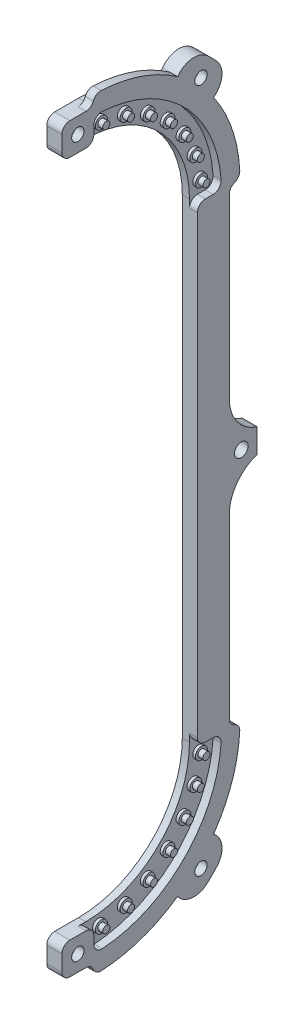
from build123d import *

# Parameters (mm, degrees)
SKETCH_1_R             = 1.6499999999999997
SKETCH_1_R_2           = 1.6499999999999986
SKETCH_1_R_3           = 1.6500000000000017
EXTRUDE_1_DEPTH        = 1.8
FILLET_1_R             = 5
FILLET_2_R             = 2
EXTRUDE_START          = 2
SKETCH_2_R             = 1.55
SKETCH_2_R_2           = 1.5500000000000007
SKETCH_2_R_3           = 1.5500000000000018
EXTRUDE_2_DEPTH        = 2
FILLET_3_R             = 2
FILLET_4_R             = 2
SKETCH_3_R             = 1.5000000000000009
SKETCH_3_R_2           = 1.4999999999999931
SKETCH_3_R_3           = 1.5000000000000007
SKETCH_3_R_4           = 1.5000000000000029
SKETCH_3_R_5           = 1.4999999999999967
EXTRUDE_3_DEPTH        = 0.7
SKETCH_4_R             = 0.9000000000000004
SKETCH_4_R_2           = 0.9000000000000007
SKETCH_4_R_3           = 0.9000000000000002
EXTRUDE_4_DEPTH        = 1.25
SKETCH_5_R             = 1.6499999999999986
EXTRUDE_5_DEPTH        = 3.8
FILLET_1_OF_MIRROR_2_R = 5
FILLET_2_OF_MIRROR_2_R = 2
FILLET_3_OF_MIRROR_2_R = 2
FILLET_4_OF_MIRROR_2_R = 2
SKETCH_6_R             = 1.6999999999999995
EXTRUDE_7_DEPTH        = 3.8
FILLET_5_R             = 10


with BuildPart() as part:
    # 草图1 → 凸台-拉伸1 (new body)
    with BuildSketch(Plane(origin=(0, 0, 0), x_dir=(0, 0, -1), z_dir=(1, 0, 0))):
        with BuildLine():
            Line((0, 26.000000000000004), (-8, 26.000000000000004))
            Line((-8, 26.000000000000004), (-8, 34))
            Line((-8, 34), (0, 34))
            ThreePointArc((0, 34), (10.223997183145261, 32.426376325439726), (19.50159883593553, 27.851169505825748))
            Line((19.50159883593553, 27.851169505825748), (24.090210326743893, 34.404385860137694))
            ThreePointArc((24.090210326743893, 34.404385860137694), (29.69848480983498, 29.698484809835016), (34.40438586013765, 24.090210326743936))
            Line((34.40438586013765, 24.090210326743936), (27.85116950582572, 19.50159883593557))
            ThreePointArc((27.85116950582572, 19.50159883593557), (32.42637632543972, 10.22399718314529), (34.00000000000001, 0))
            Line((34.00000000000001, 0), (34.00000000000002, -59.01000000000001))
            Line((34.00000000000002, -59.01000000000001), (26.00000000000003, -59.01000000000001))
            Line((26.00000000000003, -59.01000000000001), (26.000000000000004, 0))
            ThreePointArc((26.000000000000004, 0), (18.38477631085024, 18.384776310850235), (0, 26.000000000000004))
        make_face()
        with Locations((-4.000000000000001, 30.000000000000004)):
            Circle(SKETCH_1_R, mode=Mode.SUBTRACT)
        with Locations((26.870057685088806, 26.870057685088806)):
            Circle(SKETCH_1_R_2, mode=Mode.SUBTRACT)
        with Locations((30.00000000000003, -55.01000000000003)):
            Circle(SKETCH_1_R_3, mode=Mode.SUBTRACT)
    extrude_1 = extrude(amount=EXTRUDE_1_DEPTH)

    # 圆角1
    fillet_1_edges = [part.edges().sort_by_distance(p)[0] for p in [
        (0.9, 34.404385860137694, -24.090210326743893),
        (0.9, 24.090210326743936, -34.40438586013765),
    ]]
    fillet(fillet_1_edges, radius=FILLET_1_R)

    # 圆角2
    fillet_2_edges = [part.edges().sort_by_distance(p)[0] for p in [
        (0.9, 19.50159883593557, -27.851169505825716),
        (0.9, 26.000000000000004, 8),
        (0.9, 34, 8),
        (0.9, 27.851169505825744, -19.50159883593553),
    ]]
    fillet(fillet_2_edges, radius=FILLET_2_R)

    # 草图2 → 凸台-拉伸2 (add)
    with BuildSketch(Plane(origin=(1.8, 0, 0), x_dir=(0, 0, -1), z_dir=(1, 0, 0)).offset(EXTRUDE_START)):
        with BuildLine():
            Line((1.59e-15, 26.000000000000004), (0, 32))
            ThreePointArc((0, 32), (22.627416997969522, 22.62741699796952), (32, 0))
            Line((32, 0), (26.000000000000004, 0))
            Line((26.000000000000004, 0), (26.00000000000003, -59.01000000000001))
            Line((26.00000000000003, -59.01000000000001), (34.00000000000002, -59.01000000000001))
            Line((34.00000000000002, -59.01000000000001), (34, 0))
            Line((34, 0), (36.66060555964673, 0))
            ThreePointArc((36.66060555964673, 0), (34.96384094692978, 11.024056705124373), (30.030609989056998, 21.027659491373523))
            ThreePointArc((30.030609989056998, 21.027659491373523), (32.13426168184526, 24.590643085828816), (30.833366700180378, 28.518476430766917))
            ThreePointArc((30.833366700180378, 28.518476430766917), (29.69848480983498, 29.698484809835023), (28.518476430766874, 30.83336670018042))
            ThreePointArc((28.518476430766874, 30.83336670018042), (24.59064308582877, 32.1342616818453), (21.027659491373477, 30.030609989057027))
            ThreePointArc((21.027659491373477, 30.030609989057027), (11.024056705124345, 34.963840946929786), (0, 36.66060555964673))
            Line((0, 36.66060555964673), (0, 34))
            Line((0, 34), (-6, 34))
            ThreePointArc((-6, 34), (-7.414213562373095, 33.41421356237309), (-8, 32))
            Line((-8, 32), (-8, 28.000000000000004))
            ThreePointArc((-8, 28.000000000000004), (-7.414213562373096, 26.585786437626908), (-6, 26.000000000000004))
            Line((-6, 26.000000000000004), (1.59e-15, 26.000000000000004))
        make_face()
        with Locations((-4.000000000000001, 30.000000000000004)):
            Circle(SKETCH_2_R, mode=Mode.SUBTRACT)
        with Locations((26.870057685088806, 26.870057685088806)):
            Circle(SKETCH_2_R_2, mode=Mode.SUBTRACT)
        with Locations((30.00000000000003, -55.01000000000003)):
            Circle(SKETCH_2_R_3, mode=Mode.SUBTRACT)
    extrude_2 = extrude(amount=-EXTRUDE_2_DEPTH)

    # 圆角3
    fillet_3_edges = [part.edges().sort_by_distance(p)[0] for p in [
        (2.8, 0, -34),
        (2.8, 34, 0),
        (2.8, 26.000000000000004, -1.59e-15),
        (2.8, 32, 0),
        (2.8, 9.8e-16, -32),
        (2.8, 0, -26.000000000000004),
    ]]
    fillet(fillet_3_edges, radius=FILLET_3_R)

    # 圆角4
    fillet_4_edges = [part.edges().sort_by_distance(p)[0] for p in [
        (2.8, 0, -36.66060555964674),
        (2.8, 36.66060555964673, 1.78e-15),
    ]]
    fillet(fillet_4_edges, radius=FILLET_4_R)

    # 草图3 → 凸台-拉伸3 (add)
    with BuildSketch(Plane(origin=(1.8, 0, 0), x_dir=(0, 0, -1), z_dir=(1, 0, 0))):
        with Locations((20.152543263816604, 20.15254326381661)):
            Circle(SKETCH_3_R)
        with Locations((24.131639678006096, 15.162914180687096)):
            Circle(SKETCH_3_R)
        with Locations((26.90067491378847, 9.412953265722265)):
            Circle(SKETCH_3_R_2)
        with Locations((28.320797981957412, 3.1909875689442733)):
            Circle(SKETCH_3_R_3)
        with Locations((3.1909875689442595, 28.32079798195742)):
            Circle(SKETCH_3_R_4)
        with Locations((9.41295326572225, 26.900674913788485)):
            Circle(SKETCH_3_R_5)
        with Locations((15.16291418068708, 24.13163967800611)):
            Circle(SKETCH_3_R_5)
    extrude_3 = extrude(amount=EXTRUDE_3_DEPTH)

    # 草图4 → 凸台-拉伸4 (add)
    with BuildSketch(Plane(origin=(2.5, 0, 0), x_dir=(0, 0, -1), z_dir=(1, 0, 0))):
        with Locations((3.1909875689442595, 28.32079798195742)):
            Circle(SKETCH_4_R)
        with Locations((9.41295326572225, 26.900674913788485)):
            Circle(SKETCH_4_R_2)
        with Locations((15.16291418068708, 24.13163967800611)):
            Circle(SKETCH_4_R_2)
        with Locations((20.152543263816604, 20.15254326381661)):
            Circle(SKETCH_4_R_2)
        with Locations((24.131639678006096, 15.162914180687096)):
            Circle(SKETCH_4_R_3)
        with Locations((26.90067491378847, 9.412953265722265)):
            Circle(SKETCH_4_R_3)
        with Locations((28.320797981957412, 3.1909875689442733)):
            Circle(SKETCH_4_R)
    extrude_4 = extrude(amount=EXTRUDE_4_DEPTH)

    # 草图5 → 凸台-拉伸5 (add)
    with BuildSketch(Plane.ZY):
        with Locations((-30.00000000000003, -55.01000000000003)):
            Circle(SKETCH_5_R)
    extrude_5 = extrude(amount=-EXTRUDE_5_DEPTH)

    # 镜向2: 凸台-拉伸1, 凸台-拉伸2, 凸台-拉伸3, 凸台-拉伸4, 凸台-拉伸5 across plane
    add(extrude_1.mirror(Plane(origin=(1.8, -59.01000000000001, 0), x_dir=(0, 0, 1), z_dir=(0, 1, 0))))
    add(extrude_2.mirror(Plane(origin=(1.8, -59.01000000000001, 0), x_dir=(0, 0, 1), z_dir=(0, 1, 0))))
    add(extrude_3.mirror(Plane(origin=(1.8, -59.01000000000001, 0), x_dir=(0, 0, 1), z_dir=(0, 1, 0))))
    add(extrude_4.mirror(Plane(origin=(1.8, -59.01000000000001, 0), x_dir=(0, 0, 1), z_dir=(0, 1, 0))))
    add(extrude_5.mirror(Plane(origin=(1.8, -59.01000000000001, 0), x_dir=(0, 0, 1), z_dir=(0, 1, 0))))

    # 圆角1 of 镜向2
    fillet_1_of_mirror_2_edges = [part.edges().sort_by_distance(p)[0] for p in [
        (0.9, -152.4243858601377, -24.090210326743893),
        (0.9, -142.11021032674395, -34.40438586013765),
    ]]
    fillet(fillet_1_of_mirror_2_edges, radius=FILLET_1_OF_MIRROR_2_R)

    # 圆角2 of 镜向2
    fillet_2_of_mirror_2_edges = [part.edges().sort_by_distance(p)[0] for p in [
        (0.9, -137.5215988359356, -27.851169505825716),
        (0.9, -144.02000000000004, 8),
        (0.9, -152.02000000000004, 8),
        (0.9, -145.87116950582578, -19.50159883593553),
    ]]
    fillet(fillet_2_of_mirror_2_edges, radius=FILLET_2_OF_MIRROR_2_R)

    # 圆角3 of 镜向2
    fillet_3_of_mirror_2_edges = [part.edges().sort_by_distance(p)[0] for p in [
        (2.8, -118.02000000000002, -34),
        (2.8, -152.02000000000004, 0),
        (2.8, -144.02000000000004, -1.59e-15),
        (2.8, -150.02000000000004, 0),
        (2.8, -118.02000000000002, -32),
        (2.8, -118.02000000000002, -26.000000000000004),
    ]]
    fillet(fillet_3_of_mirror_2_edges, radius=FILLET_3_OF_MIRROR_2_R)

    # 圆角4 of 镜向2
    fillet_4_of_mirror_2_edges = [part.edges().sort_by_distance(p)[0] for p in [
        (2.8, -118.02000000000002, -36.66060555964674),
        (2.8, -154.68060555964675, 1.78e-15),
    ]]
    fillet(fillet_4_of_mirror_2_edges, radius=FILLET_4_OF_MIRROR_2_R)

    # 草图6 → 凸台-拉伸7 (add)
    with BuildSketch(Plane.ZY):
        Polygon((-34.000000000000014, -53.46220836013662), (-41.000000000000014, -56.01000000000002), (-41.000000000000014, -62.01000000000001), (-34.000000000000014, -64.55779163986341), align=None)
        with Locations((-37.00000000000002, -59.01000000000001)):
            Circle(SKETCH_6_R, mode=Mode.SUBTRACT)
    extrude(amount=-EXTRUDE_7_DEPTH)

    # 圆角5
    fillet_5_edges = [part.edges().sort_by_distance(p)[0] for p in [
        (1.9, -64.55779163986341, -34.000000000000014),
        (1.9, -53.46220836013662, -34.000000000000014),
    ]]
    fillet(fillet_5_edges, radius=FILLET_5_R)


solid = part.part
